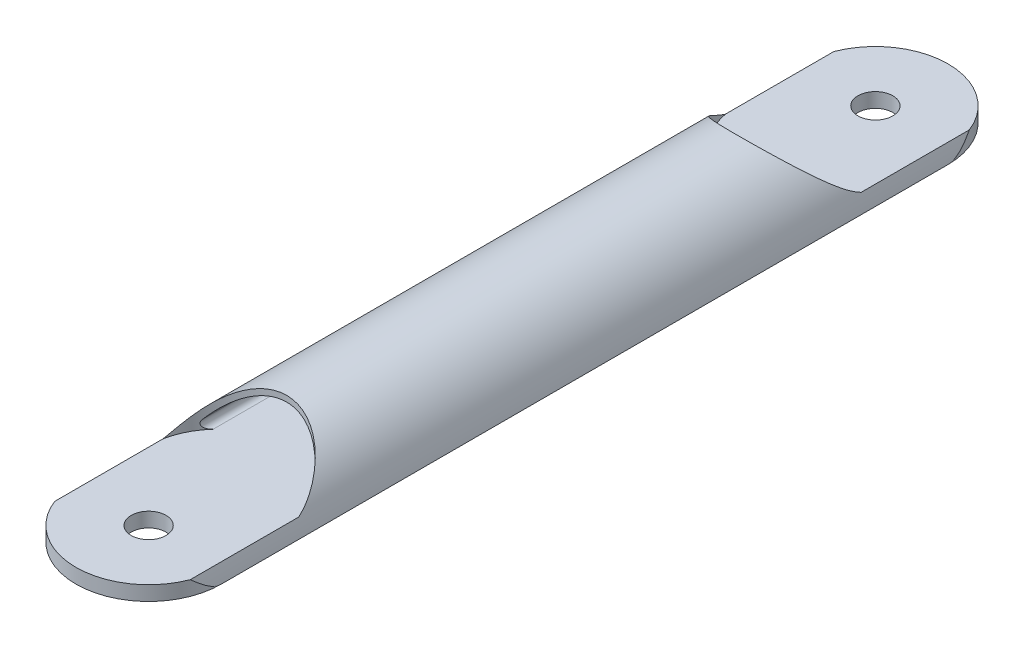
from build123d import *
from build123d.topology import SkipClean

# Parameters (mm, degrees)
BOSS_EXTRUDE1_DEPTH = 300
BOSS_EXTRUDE2_START = -300
BOSS_EXTRUDE2_DEPTH = 300
CUT_EXTRUDE2_DEPTH  = 200
CUT_EXTRUDE9_DEPTH  = 200
SKETCH6_R           = 6
CUT_EXTRUDE10_DEPTH = 200


with BuildPart() as part:
    # Sketch2 → Boss-Extrude1 (new body)
    with BuildSketch(Plane.XY):
        with BuildLine():
            Line((0, 0), (50, 0))
            ThreePointArc((50, 0), (25, 20), (0, 0))
        make_face()
        with BuildLine():
            Line((2.639320225, 2), (47.360679775, 2))
            ThreePointArc((47.360679775, 2), (25, 18), (2.639320225, 2))
        make_face(mode=Mode.SUBTRACT)
    extrude(amount=BOSS_EXTRUDE1_DEPTH)

    # Sketch3 → Boss-Extrude2 (add)
    with BuildSketch(Plane.XY.offset(300).offset(BOSS_EXTRUDE2_START)):
        with BuildLine():
            Line((7.442950134, 5), (42.557049866, 5))
            ThreePointArc((42.557049866, 5), (44.336833577, 6.087656894), (44.180823264, 8.167630058))
            ThreePointArc((44.180823264, 8.167630058), (45.998429318, 5.201199295), (47.360679775, 2))
            Line((47.360679775, 2), (2.639320225, 2))
            ThreePointArc((2.639320225, 2), (4.001570682, 5.201199295), (5.819176736, 8.167630058))
            ThreePointArc((5.819176736, 8.167630058), (5.663166423, 6.087656894), (7.442950134, 5))
        make_face()
    extrude(amount=BOSS_EXTRUDE2_DEPTH)

    # Sketch4 → Cut-Extrude2 (cut)
    with SkipClean():  # the faces are left unmerged after this step: merging them gives an invalid solid
        with BuildSketch(Plane.XZ):
            with BuildLine():
                ThreePointArc((25, 300), (42.67766953, 292.67766953), (50, 275))
                Line((50, 275), (50, 300))
                Line((50, 300), (25, 300))
            make_face()
            with BuildLine():
                Line((0, 300), (0, 275))
                ThreePointArc((0, 275), (7.32233047, 292.67766953), (25, 300))
                Line((25, 300), (0, 300))
            make_face()
            with BuildLine():
                ThreePointArc((25, 0), (7.32233047, 7.32233047), (0, 25))
                Line((0, 25), (0, 0))
                Line((0, 0), (25, 0))
            make_face()
            with BuildLine():
                Line((50, 0), (50, 25))
                ThreePointArc((50, 25), (42.67766953, 7.32233047), (25, 0))
                Line((25, 0), (50, 0))
            make_face()
        extrude(amount=-CUT_EXTRUDE2_DEPTH, mode=Mode.SUBTRACT)

    # Sketch5 → Cut-Extrude9 (cut)
    with BuildSketch(Plane(origin=(0, 5, 0), x_dir=(1, 0, 0), z_dir=(0, 1, 0))):
        with BuildLine():
            Line((7.442950134, -7.202528269), (7.442950134, -64.744139552))
            ThreePointArc((7.442950134, -64.744139552), (25, -72.5), (42.557049866, -64.744139552))
            Line((42.557049866, -64.744139552), (42.557049866, -7.202528269))
            ThreePointArc((42.557049866, -7.202528269), (34.488498478, -1.870616164), (25, 0))
            ThreePointArc((25, 0), (15.511501522, -1.870616164), (7.442950134, -7.202528269))
        make_face()
        with BuildLine():
            Line((1.25, -13.574535091), (1.25, -25))
            Line((1.25, -25), (1.25, -48.75))
            ThreePointArc((1.25, -48.75), (2.852286412, -57.325621426), (7.442950134, -64.744139552))
            Line((7.442950134, -64.744139552), (7.442950134, -7.202528269))
            ThreePointArc((7.442950134, -7.202528269), (15.511501522, -1.870616164), (25, 0))
            ThreePointArc((25, 0), (34.488498478, -1.870616164), (42.557049866, -7.202528269))
            Line((42.557049866, -7.202528269), (42.557049866, -64.744139552))
            ThreePointArc((42.557049866, -64.744139552), (47.147713588, -57.325621426), (48.75, -48.75))
            Line((48.75, -48.75), (48.75, -25))
            Line((48.75, -25), (48.75, -2.375185437))
            Line((48.75, -2.375185437), (43.657777438, 1.49490371))
            Line((43.657777438, 1.49490371), (14.161754885, 8.550430699))
            Line((14.161754885, 8.550430699), (1.25, -13.574535091))
        make_face()
        with BuildLine():
            ThreePointArc((42.557049866, -235.255860448), (25, -227.5), (7.442950134, -235.255860448))
            Line((7.442950134, -235.255860448), (7.442950134, -292.797471731))
            ThreePointArc((7.442950134, -292.797471731), (15.511501522, -298.129383836), (25, -300))
            ThreePointArc((25, -300), (34.488498478, -298.129383836), (42.557049866, -292.797471731))
            Line((42.557049866, -292.797471731), (42.557049866, -235.255860448))
        make_face()
        with BuildLine():
            Line((7.442950134, -292.797471731), (7.442950134, -235.255860448))
            ThreePointArc((7.442950134, -235.255860448), (2.852286412, -242.674378574), (1.25, -251.25))
            Line((1.25, -251.25), (1.25, -275))
            Line((1.25, -275), (1.25, -286.425464909))
            Line((1.25, -286.425464909), (14.161754885, -308.550430699))
            Line((14.161754885, -308.550430699), (43.657777438, -301.49490371))
            Line((43.657777438, -301.49490371), (48.75, -297.624814563))
            Line((48.75, -297.624814563), (48.75, -275))
            Line((48.75, -275), (48.75, -251.25))
            ThreePointArc((48.75, -251.25), (47.147713588, -242.674378574), (42.557049866, -235.255860448))
            Line((42.557049866, -235.255860448), (42.557049866, -292.797471731))
            ThreePointArc((42.557049866, -292.797471731), (34.488498478, -298.129383836), (25, -300))
            ThreePointArc((25, -300), (15.511501522, -298.129383836), (7.442950134, -292.797471731))
        make_face()
    extrude(amount=CUT_EXTRUDE9_DEPTH, mode=Mode.SUBTRACT)

    # Sketch6 → Cut-Extrude10 (cut)
    with BuildSketch(Plane(origin=(0, 5, 0), x_dir=(1, 0, 0), z_dir=(0, 1, 0))):
        with Locations(Location((25, -25, 0), (0, 0, 180))):
            Circle(SKETCH6_R)
        with Locations(Location((25, -275, 0), (0, 0, 180))):
            Circle(SKETCH6_R)
    extrude(amount=-CUT_EXTRUDE10_DEPTH, mode=Mode.SUBTRACT)


solid = part.part
